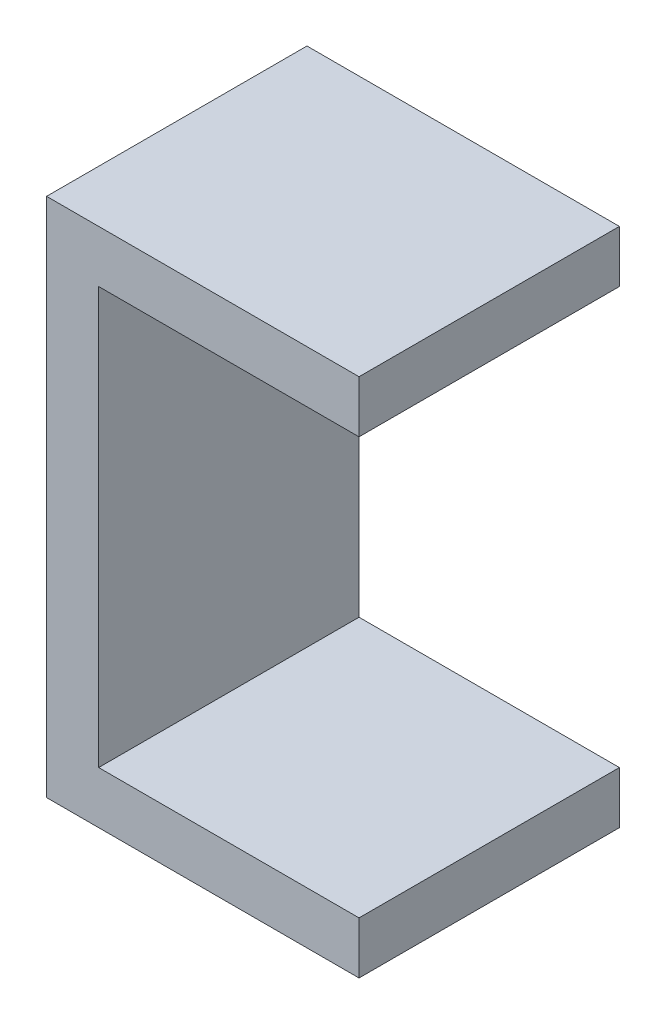
from build123d import *

# Parameters (mm, degrees)
ESTRUSIONE_ESTRUSIONE1_DEPTH = 10


with BuildPart() as part:
    # Schizzo1 → Estrusione-Estrusione1 (new body)
    with BuildSketch(Plane.XY):
        Polygon((0, 10), (0, -10), (12, -10), (12, -8), (2, -8), (2, 8), (12, 8), (12, 10), align=None)
    extrude(amount=ESTRUSIONE_ESTRUSIONE1_DEPTH)


solid = part.part
